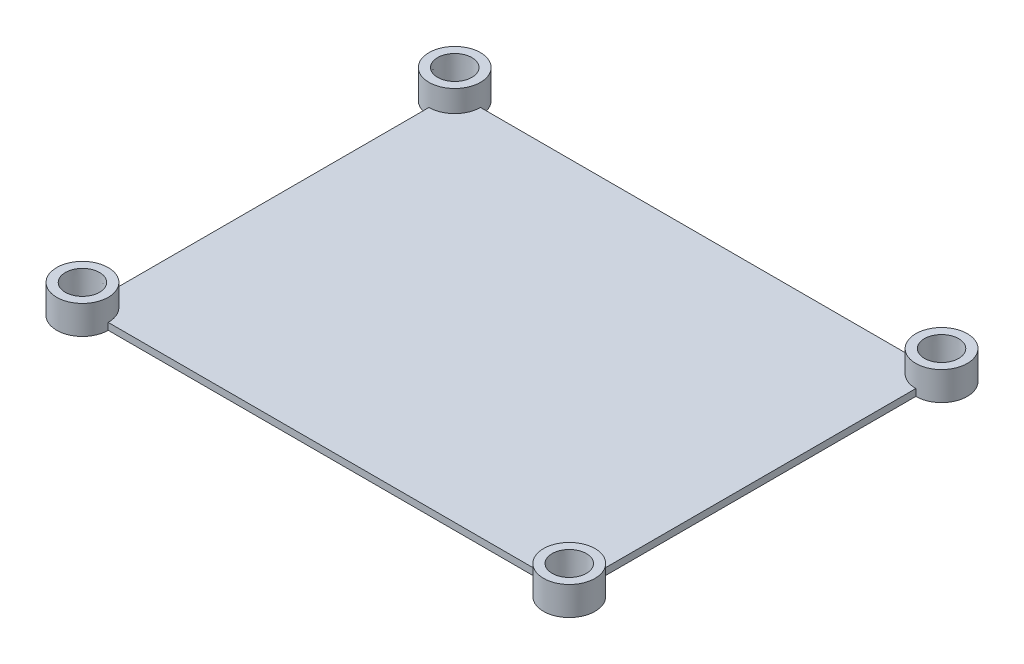
from build123d import *

# Parameters (mm, degrees)
SKETCH1_R                      = 4.5
BOSSES_DEPTH                   = 5
BOSSES_2_DEPTH                 = 5
BOSSES_3_DEPTH                 = 5
BOSSES_4_DEPTH                 = 5
SKETCH2_W                      = 85
SKETCH2_H                      = 65
BASE_DEPTH                     = 1.2
SKETCH3_R                      = 2.995
INSERT_POCKETS_DEPTH           = 4.7
INSERT_POCKETS_DRAFT           = -2
INSERT_POCKETS_PROFILE_2_DEPTH = 4.7
INSERT_POCKETS_PROFILE_2_DRAFT = -2
INSERT_POCKETS_PROFILE_3_DEPTH = 4.7
INSERT_POCKETS_PROFILE_3_DRAFT = -2
INSERT_POCKETS_PROFILE_4_DEPTH = 4.7
INSERT_POCKETS_PROFILE_4_DRAFT = -2


with BuildPart() as part:
    # Sketch1 → Bosses (new body)
    with BuildSketch(Plane(origin=(0, 0, 0), x_dir=(1, 0, 0), z_dir=(0, 1, 0))):
        with Locations(Location((0, 0, 0), (0, 0, 270))):
            Circle(SKETCH1_R)
    extrude(amount=BOSSES_DEPTH)



with BuildPart() as body_2:
    # Sketch1 → Bosses 2 (new body)
    with BuildSketch(Plane(origin=(0, 0, 0), x_dir=(1, 0, 0), z_dir=(0, 1, 0))):
        with Locations(Location((85, 0, 0), (0, 0, 270))):
            Circle(SKETCH1_R)
    extrude(amount=BOSSES_2_DEPTH)


with BuildPart() as body_3:
    # Sketch1 → Bosses 3 (new body)
    with BuildSketch(Plane(origin=(0, 0, 0), x_dir=(1, 0, 0), z_dir=(0, 1, 0))):
        with Locations(Location((85, 65, 0), (0, 0, 270))):
            Circle(SKETCH1_R)
    extrude(amount=BOSSES_3_DEPTH)


with BuildPart() as body_4:
    # Sketch1 → Bosses 4 (new body)
    with BuildSketch(Plane(origin=(0, 0, 0), x_dir=(1, 0, 0), z_dir=(0, 1, 0))):
        with Locations(Location((0, 65, 0), (0, 0, 270))):
            Circle(SKETCH1_R)
    extrude(amount=BOSSES_4_DEPTH)


with BuildPart() as part_1:
    add(part.part)

    add(body_2.part)  # Base merges body 2

    add(body_3.part)  # Base merges body 3

    add(body_4.part)  # Base merges body 4
    # Sketch2 → Base (add)
    with BuildSketch(Plane(origin=(0, 0, 0), x_dir=(1, 0, 0), z_dir=(0, 1, 0))):
        with Locations((42.5, 32.5)):
            Rectangle(SKETCH2_W, SKETCH2_H)
    extrude(amount=BASE_DEPTH)


with BuildPart() as insert_pockets_tool:
    # Sketch3 → Insert pockets (with draft: the straight prism first)
    with BuildSketch(Plane(origin=(0, 5, 0), x_dir=(1, 0, 0), z_dir=(0, 1, 0))):
        with Locations((0, 65)):
            Circle(SKETCH3_R)
    extrude(amount=-INSERT_POCKETS_DEPTH)
    # Insert pockets: the draft: its side faces are tilted about the plane it starts from
    insert_pockets_sides = [insert_pockets_tool.faces().sort_by_distance(p)[0] for p in [
        (-2.995, 2.65, -65),
    ]]
    draft(insert_pockets_sides, Plane(origin=(0, 5, 0), x_dir=(1, 0, 0), z_dir=(0, 1, 0)), INSERT_POCKETS_DRAFT)


with BuildPart() as part_2:
    add(part_1.part)

    # Insert pockets: cut by insert_pockets_tool
    add(insert_pockets_tool.part, mode=Mode.SUBTRACT)


with BuildPart() as insert_pockets_profile_2_tool:
    # Sketch3 → Insert pockets profile 2 (with draft: the straight prism first)
    with BuildSketch(Plane(origin=(0, 5, 0), x_dir=(1, 0, 0), z_dir=(0, 1, 0))):
        with Locations((85, 65)):
            Circle(SKETCH3_R)
    extrude(amount=-INSERT_POCKETS_PROFILE_2_DEPTH)
    # Insert pockets profile 2: the draft: its side faces are tilted about the plane it starts from
    insert_pockets_profile_2_sides = [insert_pockets_profile_2_tool.faces().sort_by_distance(p)[0] for p in [
        (82.005, 2.65, -65),
    ]]
    draft(insert_pockets_profile_2_sides, Plane(origin=(0, 5, 0), x_dir=(1, 0, 0), z_dir=(0, 1, 0)), INSERT_POCKETS_PROFILE_2_DRAFT)


with BuildPart() as part_3:
    add(part_2.part)

    # Insert pockets profile 2: cut by insert_pockets_profile_2_tool
    add(insert_pockets_profile_2_tool.part, mode=Mode.SUBTRACT)


with BuildPart() as insert_pockets_profile_3_tool:
    # Sketch3 → Insert pockets profile 3 (with draft: the straight prism first)
    with BuildSketch(Plane(origin=(0, 5, 0), x_dir=(1, 0, 0), z_dir=(0, 1, 0))):
        with Locations((85, 0)):
            Circle(SKETCH3_R)
    extrude(amount=-INSERT_POCKETS_PROFILE_3_DEPTH)
    # Insert pockets profile 3: the draft: its side faces are tilted about the plane it starts from
    insert_pockets_profile_3_sides = [insert_pockets_profile_3_tool.faces().sort_by_distance(p)[0] for p in [
        (82.005, 2.65, 0),
    ]]
    draft(insert_pockets_profile_3_sides, Plane(origin=(0, 5, 0), x_dir=(1, 0, 0), z_dir=(0, 1, 0)), INSERT_POCKETS_PROFILE_3_DRAFT)


with BuildPart() as part_4:
    add(part_3.part)

    # Insert pockets profile 3: cut by insert_pockets_profile_3_tool
    add(insert_pockets_profile_3_tool.part, mode=Mode.SUBTRACT)


with BuildPart() as insert_pockets_profile_4_tool:
    # Sketch3 → Insert pockets profile 4 (with draft: the straight prism first)
    with BuildSketch(Plane(origin=(0, 5, 0), x_dir=(1, 0, 0), z_dir=(0, 1, 0))):
        Circle(SKETCH3_R)
    extrude(amount=-INSERT_POCKETS_PROFILE_4_DEPTH)
    # Insert pockets profile 4: the draft: its side faces are tilted about the plane it starts from
    insert_pockets_profile_4_sides = [insert_pockets_profile_4_tool.faces().sort_by_distance(p)[0] for p in [
        (-2.995, 2.65, 0),
    ]]
    draft(insert_pockets_profile_4_sides, Plane(origin=(0, 5, 0), x_dir=(1, 0, 0), z_dir=(0, 1, 0)), INSERT_POCKETS_PROFILE_4_DRAFT)


with BuildPart() as part_5:
    add(part_4.part)

    # Insert pockets profile 4: cut by insert_pockets_profile_4_tool
    add(insert_pockets_profile_4_tool.part, mode=Mode.SUBTRACT)


solid = part_5.part
